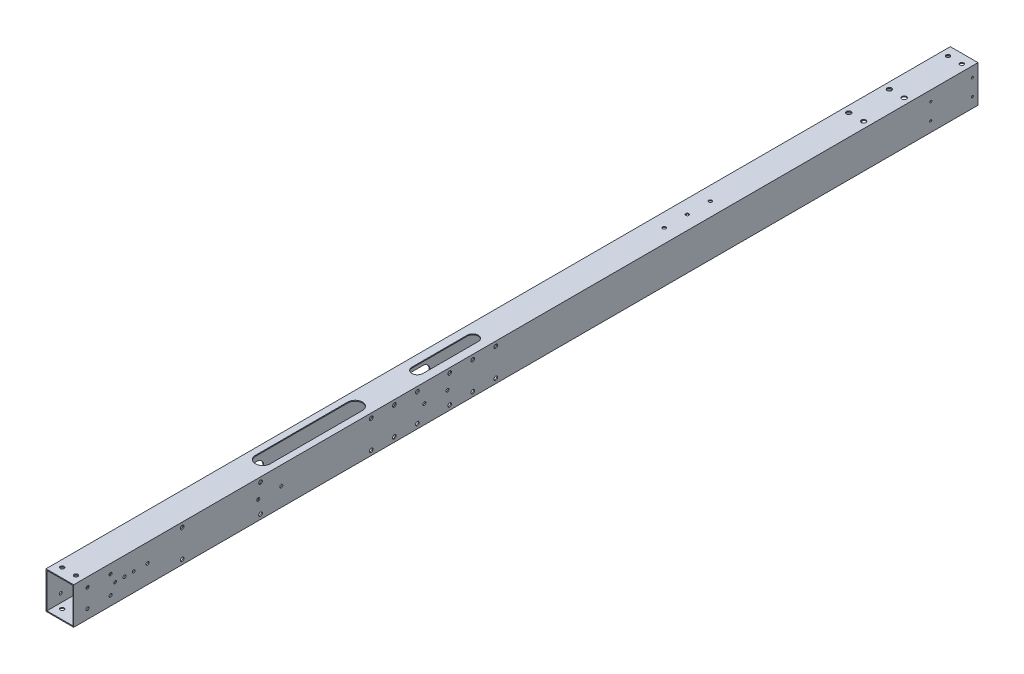
from build123d import *

# Parameters (mm, degrees)
SKETCH_1_W           = 30
SKETCH_1_H           = 40
SKETCH_1_W_2         = 28
SKETCH_1_H_2         = 38
EXTRUDE_1_DEPTH      = 940
SKETCH_5_R           = 2.5
CUT_EXTRUDE_3_DEPTH  = 941.97024395
CUT_EXTRUDE_4_DEPTH  = 1
SKETCH_7_R           = 1.5
CUT_EXTRUDE_5_DEPTH  = 1
SKETCH_17_W          = 30
SKETCH_17_H          = 40
SKETCH_17_W_2        = 28
SKETCH_17_H_2        = 38
EXTRUDE_2_DEPTH      = 20
SKETCH_18_W          = 30
SKETCH_18_H          = 40
SKETCH_18_W_2        = 28
SKETCH_18_H_2        = 38
EXTRUDE_3_DEPTH      = 20
SKETCH_19_R          = 2.1
CUT_EXTRUDE_16_DEPTH = 961.950050731
SKETCH_20_R          = 1.6
CUT_EXTRUDE_17_DEPTH = 961.67684473
SKETCH_23_R          = 2.5
CUT_EXTRUDE_19_DEPTH = 961.950050731
SKETCH_24_R          = 4.5
CUT_EXTRUDE_20_DEPTH = 10
SKETCH_25_W          = 114.67616049
SKETCH_25_H          = 1154.562704257
CUT_EXTRUDE_21_DEPTH = 968.690549711
SKETCH_26_R          = 2
CUT_EXTRUDE_22_DEPTH = 961.67684473
CUT_EXTRUDE_23_DEPTH = 10
SKETCH_28_R          = 1.5
CUT_EXTRUDE_24_DEPTH = 10
SKETCH_29_R          = 1.5
CUT_EXTRUDE_25_DEPTH = 10
CUT_EXTRUDE_26_DEPTH = 10
SKETCH_31_R          = 1.75
CUT_EXTRUDE_27_DEPTH = 10
SKETCH_34_W          = 100
SKETCH_34_H          = 30
CUT_EXTRUDE_28_DEPTH = 10
EXTRUDE_4_DEPTH      = 1
SKETCH_36_W          = 50.706907747
SKETCH_36_H          = 15.381529857
EXTRUDE_5_DEPTH      = 1
FILLET_1_R           = 3
SKETCH_37_R          = 1.75
CUT_EXTRUDE_29_DEPTH = 81
SKETCH_39_W          = 33.04876618
SKETCH_39_H          = 8.235453061
SKETCH_39_W_2        = 28.839368921
SKETCH_39_H_2        = 9.938064258
EXTRUDE_6_DEPTH      = 1
SKETCH_41_W          = 53.968695117
SKETCH_41_H          = 20.437849039
SKETCH_41_W_2        = 57.741002254
SKETCH_41_H_2        = 19.227533359
EXTRUDE_7_DEPTH      = 1
SKETCH_38_R          = 1.65
CUT_EXTRUDE_30_DEPTH = 93
CUT_EXTRUDE_31_DEPTH = 1
SKETCH_43_R          = 1.15
CUT_EXTRUDE_32_DEPTH = 39
CUT_EXTRUDE_START    = -5
CUT_EXTRUDE_33_DEPTH = 40


with BuildPart() as part:
    # 草图1 → 凸台-拉伸1 (new body)
    with BuildSketch(Plane.XY):
        Rectangle(SKETCH_1_W, SKETCH_1_H)
        Rectangle(SKETCH_1_W_2, SKETCH_1_H_2, mode=Mode.SUBTRACT)
    extrude(amount=EXTRUDE_1_DEPTH)

    # 草图5 → 切除-拉伸3 (cut, through all)
    with BuildSketch(Plane.XZ.offset(20)):
        with Locations((-8, 53)):
            Circle(SKETCH_5_R)
        with Locations((8, 53)):
            Circle(SKETCH_5_R)
        with Locations((-8, 97)):
            Circle(SKETCH_5_R)
        with Locations((8, 97)):
            Circle(SKETCH_5_R)
    extrude(amount=-CUT_EXTRUDE_3_DEPTH, mode=Mode.SUBTRACT)

    # 草图6 → 切除-拉伸4 (cut)
    with BuildSketch(Plane(origin=(15, 0, 0), x_dir=(0, 0, -1), z_dir=(1, 0, 0))):
        with BuildLine():
            Line((-345, -7.5), (-375, -7.5))
            ThreePointArc((-375, -7.5), (-382.5, 0), (-375, 7.5))
            Line((-375, 7.5), (-345, 7.5))
            ThreePointArc((-345, 7.5), (-337.5, 0), (-345, -7.5))
        make_face()
        with BuildLine():
            Line((-525, -7.5), (-555, -7.5))
            ThreePointArc((-555, -7.5), (-562.5, 0), (-555, 7.5))
            Line((-555, 7.5), (-525, 7.5))
            ThreePointArc((-525, 7.5), (-517.5, 0), (-525, -7.5))
        make_face()
        with BuildLine():
            Line((-705, -7.5), (-735, -7.5))
            ThreePointArc((-735, -7.5), (-742.5, 0), (-735, 7.5))
            Line((-735, 7.5), (-705, 7.5))
            ThreePointArc((-705, 7.5), (-697.5, 0), (-705, -7.5))
        make_face()
    extrude(amount=-CUT_EXTRUDE_4_DEPTH, mode=Mode.SUBTRACT)

    # 草图7 → 切除-拉伸5 (cut)
    with BuildSketch(Plane.ZY.offset(15)):
        with Locations((350, 0)):
            Circle(SKETCH_7_R)
        with Locations((370, 0)):
            Circle(SKETCH_7_R)
        with Locations((530, 0)):
            Circle(SKETCH_7_R)
        with Locations((550, 0)):
            Circle(SKETCH_7_R)
        with Locations((710, 0)):
            Circle(SKETCH_7_R)
        with Locations((730, 0)):
            Circle(SKETCH_7_R)
    extrude(amount=-CUT_EXTRUDE_5_DEPTH, mode=Mode.SUBTRACT)

    # 草图17 → 凸台-拉伸2 (add)
    with BuildSketch(Plane.XY.offset(940)):
        Rectangle(SKETCH_17_W, SKETCH_17_H)
        Rectangle(SKETCH_17_W_2, SKETCH_17_H_2, mode=Mode.SUBTRACT)
    extrude(amount=EXTRUDE_2_DEPTH)

    # 草图18 → 凸台-拉伸3 (add)
    with BuildSketch(Plane(origin=(0, 0, 0), x_dir=(-1, 0, 0), z_dir=(0, 0, -1))):
        Rectangle(SKETCH_18_W, SKETCH_18_H)
        Rectangle(SKETCH_18_W_2, SKETCH_18_H_2, mode=Mode.SUBTRACT)
    extrude(amount=EXTRUDE_3_DEPTH)

    # 草图19 → 切除-拉伸16 (cut, through all)
    with BuildSketch(Plane(origin=(0, 20, 0), x_dir=(1, 0, 0), z_dir=(0, 1, 0))):
        with Locations((-7.5, -950)):
            Circle(SKETCH_19_R)
        with Locations((7.5, -950)):
            Circle(SKETCH_19_R)
        with Locations((-7.5, 10)):
            Circle(SKETCH_19_R)
        with Locations((7.5, 10)):
            Circle(SKETCH_19_R)
    extrude(amount=-CUT_EXTRUDE_16_DEPTH, mode=Mode.SUBTRACT)

    # 草图20 → 切除-拉伸17 (cut, through all)
    with BuildSketch(Plane(origin=(15, 0, 0), x_dir=(0, 0, -1), z_dir=(1, 0, 0))):
        with Locations((-945, 10)):
            Circle(SKETCH_20_R)
        with Locations((-920, 10)):
            Circle(SKETCH_20_R)
        with Locations((-920, -10)):
            Circle(SKETCH_20_R)
        with Locations((-945, -10)):
            Circle(SKETCH_20_R)
    extrude(amount=-CUT_EXTRUDE_17_DEPTH, mode=Mode.SUBTRACT)

    # 草图23 → 切除-拉伸19 (cut, through all)
    with BuildSketch(Plane(origin=(0, 20, 0), x_dir=(1, 0, 0), z_dir=(0, 1, 0))):
        with Locations((0, -520)):
            Circle(SKETCH_23_R)
        with Locations((0, -535)):
            Circle(SKETCH_23_R)
        with Locations((0, -550)):
            Circle(SKETCH_23_R)
        with Locations((0, -565)):
            Circle(SKETCH_23_R)
    extrude(amount=-CUT_EXTRUDE_19_DEPTH, mode=Mode.SUBTRACT)

    # 草图24 → 切除-拉伸20 (cut)
    with BuildSketch(Plane(origin=(0, 20, 0), x_dir=(1, 0, 0), z_dir=(0, 1, 0))):
        with Locations((0, -520)):
            Circle(SKETCH_24_R)
        with Locations((0, -535)):
            Circle(SKETCH_24_R)
        with Locations((0, -550)):
            Circle(SKETCH_24_R)
        with Locations((0, -565)):
            Circle(SKETCH_24_R)
    extrude(amount=-CUT_EXTRUDE_20_DEPTH, mode=Mode.SUBTRACT)


with BuildPart() as body_2:
    # 镜向2: mirrored copy
    add(part.part.mirror(Plane(origin=(-50, 0, 0), x_dir=(0, 0, 1), z_dir=(1, 0, 0))))

    # 草图26 → 切除-拉伸22 (cut, through all)
    with BuildSketch(Plane.ZY.offset(115)):
        with Locations((612.5, 15)):
            Circle(SKETCH_26_R)
        with Locations((612.5, -15)):
            Circle(SKETCH_26_R)
        with Locations((527.5, 15)):
            Circle(SKETCH_26_R)
        with Locations((527.5, -15)):
            Circle(SKETCH_26_R)
        with Locations((842.5, 15)):
            Circle(SKETCH_26_R)
        with Locations((842.5, -15)):
            Circle(SKETCH_26_R)
        with Locations((757.5, 15)):
            Circle(SKETCH_26_R)
        with Locations((757.5, -15)):
            Circle(SKETCH_26_R)
        with Locations((637.5, 15)):
            Circle(SKETCH_26_R)
        with Locations((637.5, -15)):
            Circle(SKETCH_26_R)
        with Locations((552.5, -15)):
            Circle(SKETCH_26_R)
        with Locations((552.5, 15)):
            Circle(SKETCH_26_R)
        with Locations((502.5, 15)):
            Circle(SKETCH_26_R)
        with Locations((502.5, -15)):
            Circle(SKETCH_26_R)
        with Locations((587.5, -15)):
            Circle(SKETCH_26_R)
        with Locations((587.5, 15)):
            Circle(SKETCH_26_R)
    extrude(amount=-CUT_EXTRUDE_22_DEPTH, mode=Mode.SUBTRACT)

    # 草图27 → 切除-拉伸23 (cut)
    with BuildSketch(Plane(origin=(0, 20, 0), x_dir=(1, 0, 0), z_dir=(0, 1, 0))):
        with BuildLine():
            Line((-94, -512.5), (-94, -572.5))
            ThreePointArc((-94, -572.5), (-100, -578.5), (-106, -572.5))
            Line((-106, -572.5), (-106, -512.5))
            ThreePointArc((-106, -512.5), (-100, -506.5), (-94, -512.5))
        make_face()
    extrude(amount=-CUT_EXTRUDE_23_DEPTH, mode=Mode.SUBTRACT)

    # 草图28 → 切除-拉伸24 (cut)
    with BuildSketch(Plane(origin=(-85, 0, 0), x_dir=(0, 0, -1), z_dir=(1, 0, 0))):
        with Locations((-730, 0)):
            Circle(SKETCH_28_R)
        with Locations((-710, 0)):
            Circle(SKETCH_28_R)
        with Locations((-915, 0)):
            Circle(SKETCH_28_R)
        with Locations((-895, 0)):
            Circle(SKETCH_28_R)
    extrude(amount=-CUT_EXTRUDE_24_DEPTH, mode=Mode.SUBTRACT)

    # 草图29 → 切除-拉伸25 (cut)
    with BuildSketch(Plane.XZ.offset(20)):
        with Locations((-105, 740)):
            Circle(SKETCH_29_R)
        with Locations((-105, 720)):
            Circle(SKETCH_29_R)
        with Locations((-105, 700)):
            Circle(SKETCH_29_R)
        with Locations((-105, 680)):
            Circle(SKETCH_29_R)
        with Locations((-105, 660)):
            Circle(SKETCH_29_R)
        with Locations((-105, 640)):
            Circle(SKETCH_29_R)
        with Locations((-105, 620)):
            Circle(SKETCH_29_R)
    extrude(amount=-CUT_EXTRUDE_25_DEPTH, mode=Mode.SUBTRACT)

    # 草图30 → 切除-拉伸26 (cut)
    with BuildSketch(Plane(origin=(0, 20, 0), x_dir=(1, 0, 0), z_dir=(0, 1, 0))):
        with BuildLine():
            Line((-92, -640), (-92, -740))
            ThreePointArc((-92, -740), (-100, -748), (-108, -740))
            Line((-108, -740), (-108, -640))
            ThreePointArc((-108, -640), (-100, -632), (-92, -640))
        make_face()
    extrude(amount=-CUT_EXTRUDE_26_DEPTH, mode=Mode.SUBTRACT)

    # 草图31 → 切除-拉伸27 (cut)
    with BuildSketch(Plane.XZ.offset(20)):
        with Locations((-100, 137)):
            Circle(SKETCH_31_R)
        with Locations((-100, 177)):
            Circle(SKETCH_31_R)
    extrude(amount=-CUT_EXTRUDE_27_DEPTH, mode=Mode.SUBTRACT)

    # 草图34 → 切除-拉伸28 (cut)
    with BuildSketch(Plane.ZY.offset(115)):
        with Locations((280, -4)):
            Rectangle(SKETCH_34_W, SKETCH_34_H)
    extrude(amount=-CUT_EXTRUDE_28_DEPTH, mode=Mode.SUBTRACT)

    # 草图35 → 凸台-拉伸4 (add)
    with BuildSketch(Plane.ZY.offset(115)):
        Polygon((336.145770334, -4), (350, -4), (350, -9.077366936), (391.920925018, -9.077366936), (391.920925018, 11.093373936), (336.145770334, 11.093373936), align=None)
    extrude(amount=-EXTRUDE_4_DEPTH)

    # 草图36 → 凸台-拉伸5 (add)
    with BuildSketch(Plane(origin=(-85, 0, 0), x_dir=(0, 0, -1), z_dir=(1, 0, 0))):
        with Locations((-354.422343157, -1.974054468)):
            Rectangle(SKETCH_36_W, SKETCH_36_H)
    extrude(amount=-EXTRUDE_5_DEPTH)

    # 圆角1
    fillet_1_edges = [body_2.edges().sort_by_distance(p)[0] for p in [
        (-114.5, -19, 330),
        (-114.5, 11, 230),
        (-114.5, -19, 230),
    ]]
    fillet(fillet_1_edges, radius=FILLET_1_R)

    # 草图37 → 切除-拉伸29 (cut)
    with BuildSketch(Plane.XZ.offset(20)):
        with Locations((-100, 255)):
            Circle(SKETCH_37_R)
        with Locations((-100, 305)):
            Circle(SKETCH_37_R)
        with Locations((-100, 280)):
            Circle(SKETCH_37_R)
    extrude(amount=-CUT_EXTRUDE_29_DEPTH, mode=Mode.SUBTRACT)

    # 草图39 → 凸台-拉伸6 (add)
    with BuildSketch(Plane(origin=(-85, 0, 0), x_dir=(0, 0, -1), z_dir=(1, 0, 0))):
        with Locations((-716.005404382, 0.278572404)):
            Rectangle(SKETCH_39_W, SKETCH_39_H)
        with Locations((-538.020368458, 0.344207478)):
            Rectangle(SKETCH_39_W_2, SKETCH_39_H_2)
    extrude(amount=-EXTRUDE_6_DEPTH)

    # 草图41 → 凸台-拉伸7 (add)
    with BuildSketch(Plane.ZY.offset(115)):
        with Locations((541.407114178, 0.400095075)):
            Rectangle(SKETCH_41_W, SKETCH_41_H)
        with Locations((717.500112012, 1.005252915)):
            Rectangle(SKETCH_41_W_2, SKETCH_41_H_2)
    extrude(amount=-EXTRUDE_7_DEPTH)

    # 草图38 → 切除-拉伸30 (cut)
    with BuildSketch(Plane(origin=(-85, 0, 0), x_dir=(0, 0, -1), z_dir=(1, 0, 0))):
        with Locations((-905, 0)):
            Circle(SKETCH_38_R)
        with Locations((-880, 0)):
            Circle(SKETCH_38_R)
        with Locations((-760, 0)):
            Circle(SKETCH_38_R)
        with Locations((-735, 0)):
            Circle(SKETCH_38_R)
        with Locations((-580, 0)):
            Circle(SKETCH_38_R)
        with Locations((-555, 0)):
            Circle(SKETCH_38_R)
    extrude(amount=-CUT_EXTRUDE_30_DEPTH, mode=Mode.SUBTRACT)

    # 草图42 → 切除-拉伸31 (cut)
    with BuildSketch(Plane.ZY.offset(115)):
        with BuildLine():
            Line((877.5, 7.5), (907.5, 7.5))
            ThreePointArc((907.5, 7.5), (915, 0), (907.5, -7.5))
            Line((907.5, -7.5), (877.5, -7.5))
            ThreePointArc((877.5, -7.5), (870, 0), (877.5, 7.5))
        make_face()
        with BuildLine():
            Line((732.5, 7.5), (762.5, 7.5))
            ThreePointArc((762.5, 7.5), (770, 0), (762.5, -7.5))
            Line((762.5, -7.5), (732.5, -7.5))
            ThreePointArc((732.5, -7.5), (725, 0), (732.5, 7.5))
        make_face()
        with BuildLine():
            Line((552.5, 7.5), (582.5, 7.5))
            ThreePointArc((582.5, 7.5), (590, 0), (582.5, -7.5))
            Line((582.5, -7.5), (552.5, -7.5))
            ThreePointArc((552.5, -7.5), (545, 0), (552.5, 7.5))
        make_face()
    extrude(amount=-CUT_EXTRUDE_31_DEPTH, mode=Mode.SUBTRACT)

    # 草图43 → 切除-拉伸32 (cut)
    with BuildSketch(Plane.ZY.offset(115)):
        with Locations((-14, 9)):
            Circle(SKETCH_43_R)
        with Locations((31.2, 9)):
            Circle(SKETCH_43_R)
        with Locations((31.2, -9)):
            Circle(SKETCH_43_R)
        with Locations((-14, -9)):
            Circle(SKETCH_43_R)
    extrude(amount=-CUT_EXTRUDE_32_DEPTH, mode=Mode.SUBTRACT)

    # 草图44 → 切除-拉伸33 (cut)
    with BuildSketch(Plane(origin=(-85, 0, 0), x_dir=(0, 0, -1), z_dir=(1, 0, 0)).offset(CUT_EXTRUDE_START)):
        with BuildLine():
            Line((-65, 12), (-5, 12))
            ThreePointArc((-5, 12), (7, 0), (-5, -12))
            Line((-5, -12), (-65, -12))
            ThreePointArc((-65, -12), (-77, 0), (-65, 12))
        make_face()
    extrude(amount=-CUT_EXTRUDE_33_DEPTH, mode=Mode.SUBTRACT)


with BuildPart() as part_1:
    add(part.part)

    # 草图25 → 切除-拉伸21 (cut, through all)
    with BuildSketch(Plane(origin=(0, 20, 0), x_dir=(1, 0, 0), z_dir=(0, 1, 0))):
        with Locations((7.338080245, -506.215166959)):
            Rectangle(SKETCH_25_W, SKETCH_25_H)
    extrude(amount=-CUT_EXTRUDE_21_DEPTH, mode=Mode.SUBTRACT)


solid = body_2.part
